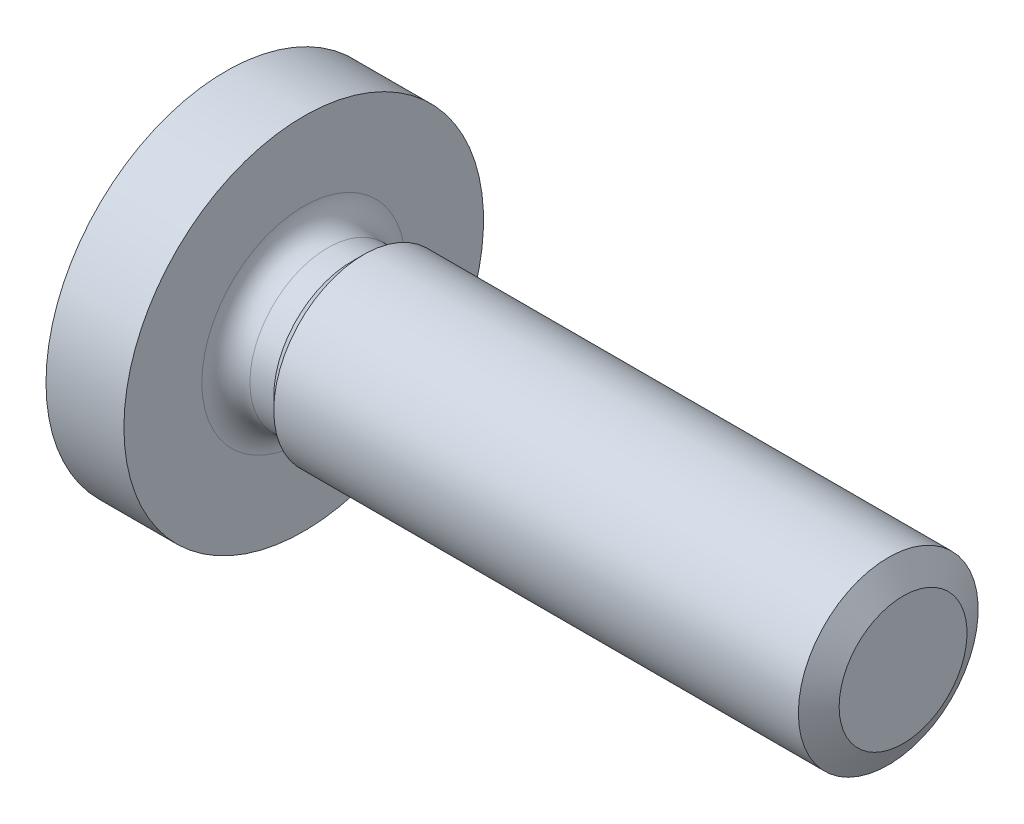
from build123d import *


with BuildPart() as part:
    # 草图2 → Revolve 709 (revolve)
    with BuildSketch(Plane.XY, mode=Mode.PRIVATE) as revolve_709_sk:
        with BuildLine():
            Line((0, 0), (24.6, 0))
            Line((24.6, 0), (24.6, 3))
            Line((24.6, 3), (6.6, 3))
            Line((6.6, 3), (6.198, 2.598))
            Line((6.198, 2.598), (5.402, 2.598))
            ThreePointArc((5.402, 2.598), (4.834900361, 2.832900361), (4.6, 3.4))
            Line((4.6, 3.4), (4.6, 6))
            Line((4.6, 6), (2, 6))
            ThreePointArc((2, 6), (0.513167019, 3.16227766), (0, 0))
        make_face()
    revolve(revolve_709_sk.sketch.rotate(Axis((-1.331757704, 0, 0), (1, 0, 0)), 90), axis=Axis((-1.331757704, 0, 0), (1, 0, 0)))

    # 草图3 → 切除-旋转1 (revolve, cut)
    with BuildSketch(Plane.XY, mode=Mode.PRIVATE) as cut_revolve_1_sk:
        Polygon((24.105416006, 3), (25.105416006, 3), (24.6, 2.134), align=None)
    revolve(cut_revolve_1_sk.sketch.rotate(Axis((-0.242766179, 0, 0), (1, 0, 0)), 90), axis=Axis((-0.242766179, 0, 0), (1, 0, 0)), mode=Mode.SUBTRACT)

    # 草图5 → 切除-放样1 section 0
    with BuildSketch(Plane(origin=(0, 0, 0), x_dir=(0, 0, -1), z_dir=(1, 0, 0)), mode=Mode.PRIVATE) as loft_1_s0:
        with BuildLine():
            Line((0.5, 3.45), (-0.5, 3.45))
            Line((-0.5, 3.45), (-0.5, -3.45))
            Line((-0.5, -3.45), (0.5, -3.45))
            Line((0.5, -3.45), (0.5, 3.45))
        make_face()
    loft_1 = loft([Vertex(3.6, 0, 0), loft_1_s0.sketch], mode=Mode.SUBTRACT)

    # 镜向1: 切除-放样1 across plane
    add(loft_1.mirror(Plane(origin=(0, 0, 0), x_dir=(0, 0.7071067811865462, 0.7071067811865488), z_dir=(0, -0.7071067811865488, 0.7071067811865462))), mode=Mode.SUBTRACT)


solid = part.part
